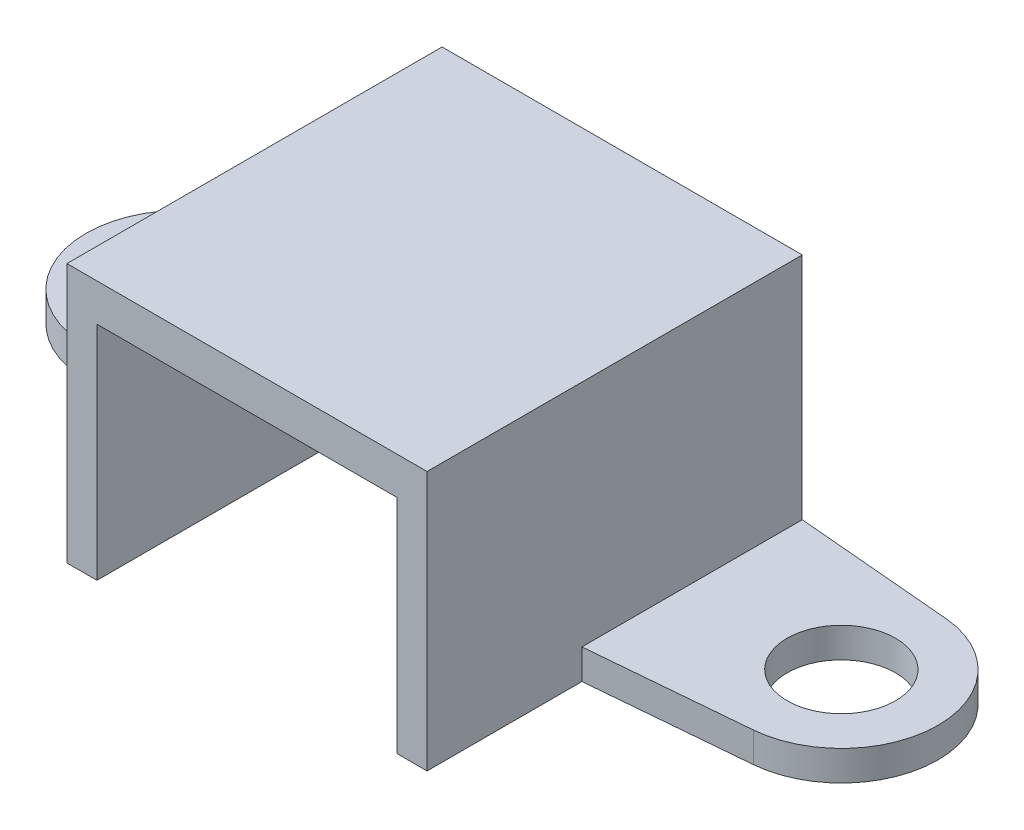
from build123d import *

# Parameters (mm, degrees)
SALIENTE_EXTRUIR1_DEPTH = 15
CROQUIS2_R              = 2.167600076
SALIENTE_EXTRUIR2_DEPTH = 1.2


with BuildPart() as part:
    # Croquis1 → Saliente-Extruir1 (new body)
    with BuildSketch(Plane.XY):
        Polygon((0, 0), (0, 10.369319961), (14.4, 10.369319961), (14.4, 0), (13.2, 0), (13.2, 8.869319961), (1.2, 8.869319961), (1.2, 0), align=None)
    extrude(amount=-SALIENTE_EXTRUIR1_DEPTH)

    # Croquis2 → Saliente-Extruir2 (add)
    # profile 1 of 2: a face of its own
    with BuildSketch(Plane.XZ):
        with BuildLine():
            ThreePointArc((20.704683633, -6.742646275), (24.235200152, -10.595528965), (20.704683633, -14.448411655))
            Line((20.704683633, -14.448411655), (14.4, -15))
            Line((14.4, -15), (14.4, -6.19105793))
            Line((14.4, -6.19105793), (20.704683633, -6.742646275))
        make_face()
        with Locations(Location((20.367600076, -10.595528965, 0), (0, 0, 270))):
            Circle(CROQUIS2_R, mode=Mode.SUBTRACT)
    # profile 2 of 2: a face of its own
    with BuildSketch(Plane.XZ):
        with BuildLine():
            Line((-6.304683633, -14.448411655), (0, -15))
            Line((0, -15), (0, -6.19105793))
            Line((0, -6.19105793), (-6.304683633, -6.742646275))
            ThreePointArc((-6.304683633, -6.742646275), (-9.835200152, -10.595528965), (-6.304683633, -14.448411655))
        make_face()
        with Locations(Location((-5.967600076, -10.595528965, 0), (0, 0, 270))):
            Circle(CROQUIS2_R, mode=Mode.SUBTRACT)
    extrude(amount=-SALIENTE_EXTRUIR2_DEPTH)


solid = part.part
